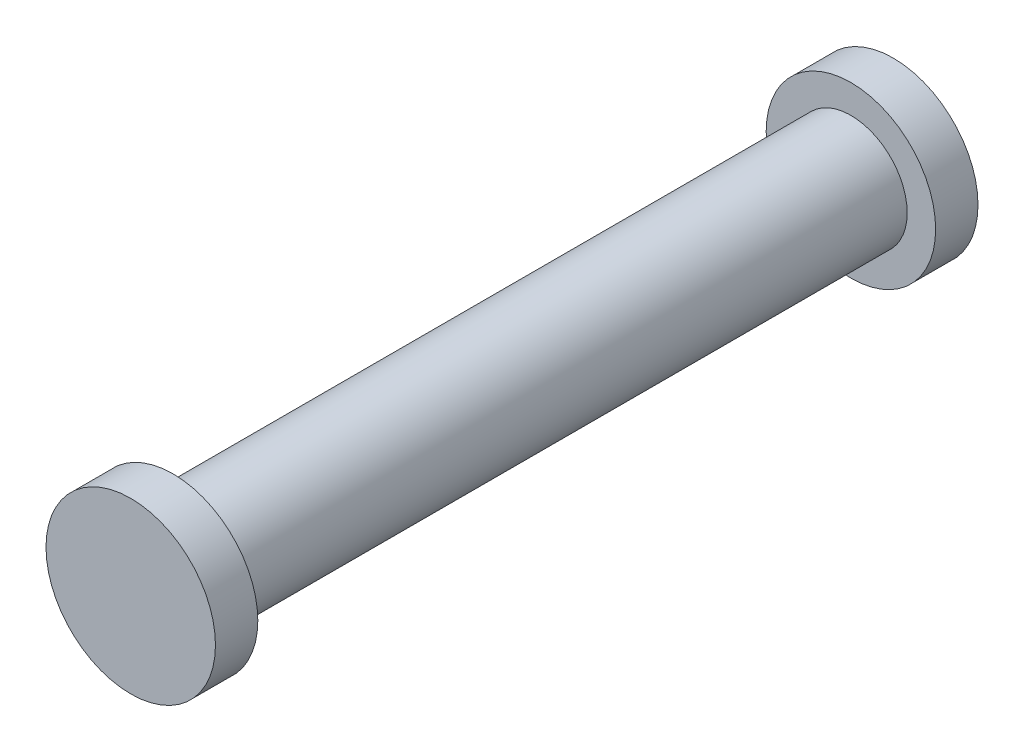
from build123d import *

# Parameters (mm, degrees)
SKETCH1_R           = 4.2164
BOSS_EXTRUDE1_DEPTH = 50.8
SKETCH2_R           = 6.35
BOSS_EXTRUDE2_DEPTH = 3.175
BOSS_EXTRUDE3_START = 3.175
SKETCH3_R           = 6.35
BOSS_EXTRUDE3_DEPTH = 3.175


with BuildPart() as part:
    # Sketch1 → Boss-Extrude1 (new body)
    with BuildSketch(Plane.XY):
        Circle(SKETCH1_R)
    extrude(amount=BOSS_EXTRUDE1_DEPTH)

    # Sketch2 → Boss-Extrude2 (add)
    with BuildSketch(Plane.XY.offset(50.8)):
        Circle(SKETCH2_R)
    extrude(amount=BOSS_EXTRUDE2_DEPTH)

    # Sketch3 → Boss-Extrude3 (add)
    with BuildSketch(Plane(origin=(0, 0, 0), x_dir=(-1, 0, 0), z_dir=(0, 0, -1)).offset(BOSS_EXTRUDE3_START)):
        with Locations(Location((0, 0, 0), (0, 0, 180))):
            Circle(SKETCH3_R)
    extrude(amount=-BOSS_EXTRUDE3_DEPTH)


solid = part.part
